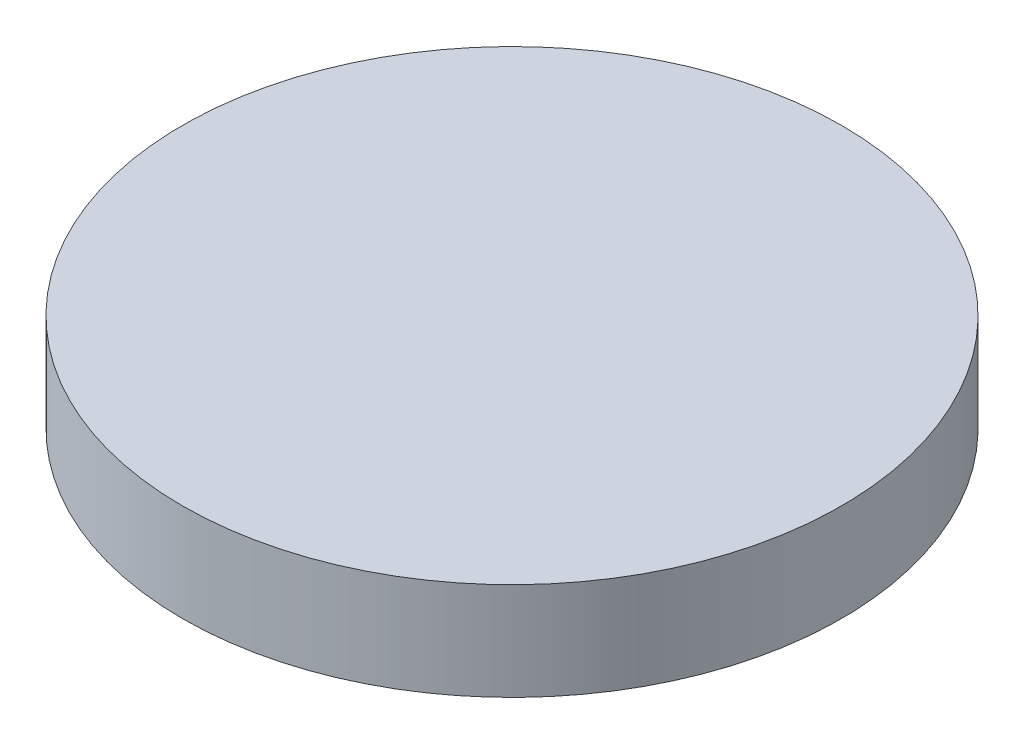
from build123d import *

# Parameters (mm, degrees)
SKETCH1_R           = 27
BOSS_EXTRUDE1_DEPTH = 8


with BuildPart() as part:
    # Sketch1 → Boss-Extrude1 (new body)
    with BuildSketch(Plane(origin=(0, 0, 0), x_dir=(1, 0, 0), z_dir=(0, 1, 0))):
        with Locations(Location((0, 0, 0), (0, 0, 270))):
            Circle(SKETCH1_R)
    extrude(amount=BOSS_EXTRUDE1_DEPTH)


solid = part.part
